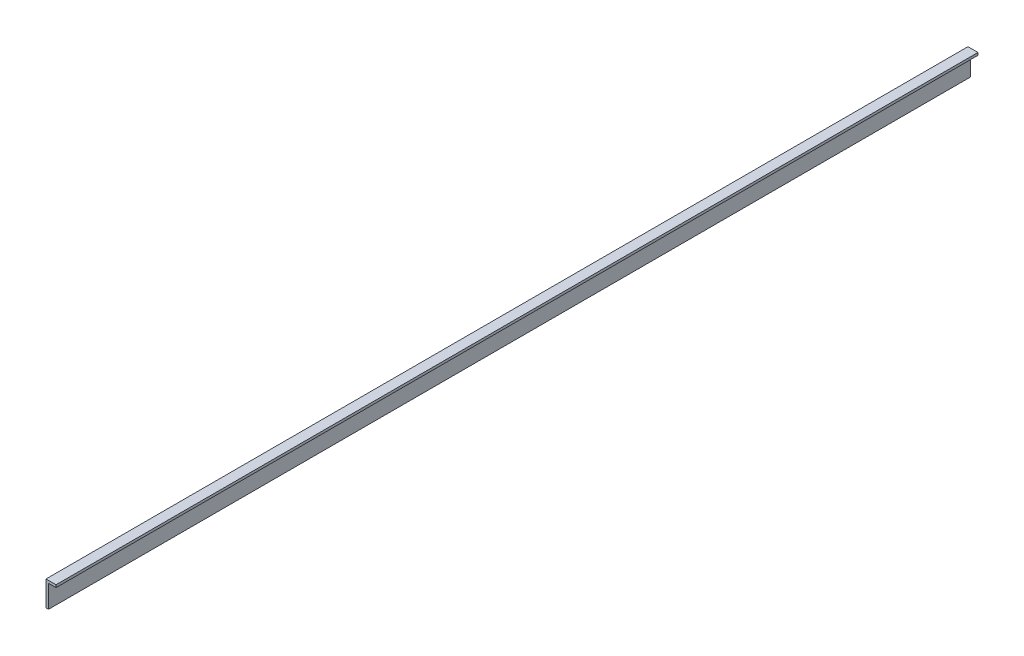
from build123d import *

# Parameters (mm, degrees)
STORE_KASET_L_RAF_1_SOL_1_START = -20
STORE_KASET_L_RAF_1_SOL_1_DEPTH = 735.5


with BuildPart() as part:
    # Sketch1 → STORE_kaset_L_raf_1_sol_1 (new body)
    with BuildSketch(Plane.XY.offset(STORE_KASET_L_RAF_1_SOL_1_START)):
        Polygon((97.5, 404.5), (95.5, 404.5), (95.5, 424.5), (103.5, 424.5), (103.5, 422.5), (97.5, 422.5), align=None)
    extrude(amount=-STORE_KASET_L_RAF_1_SOL_1_DEPTH)


solid = part.part
